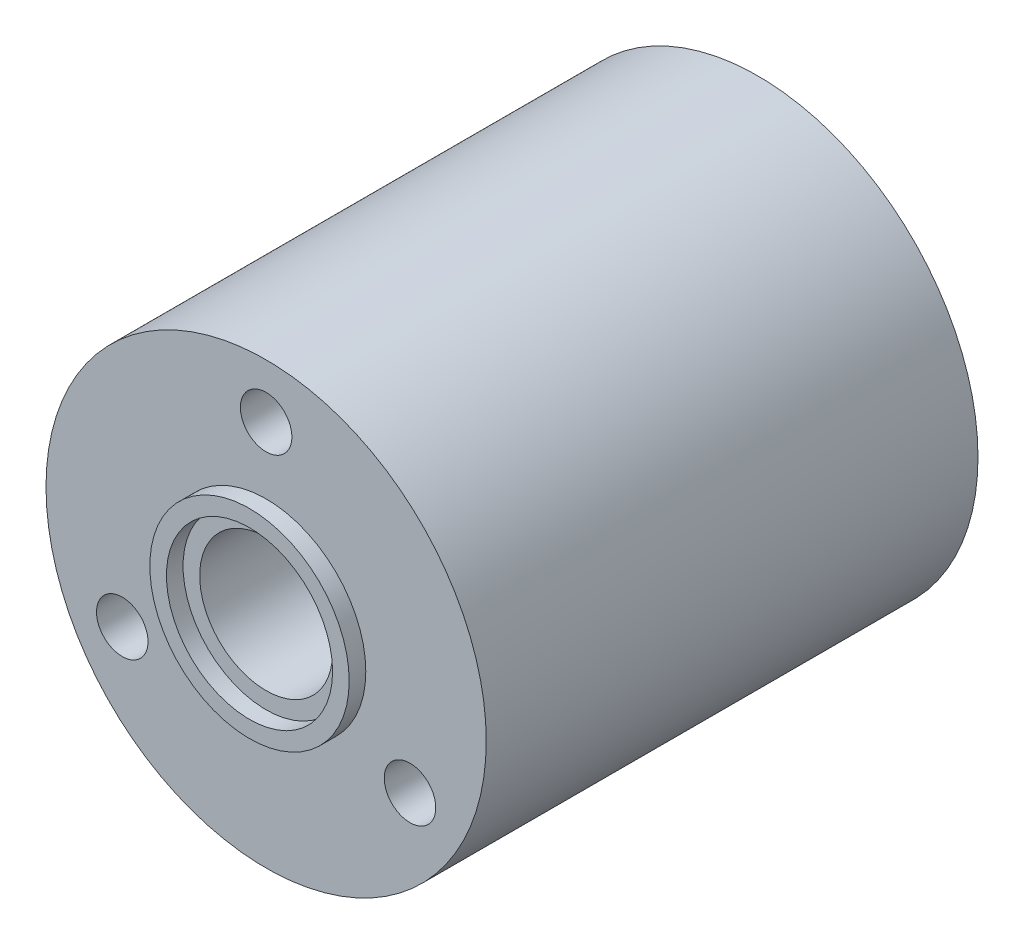
from build123d import *

# Parameters (mm, degrees)
SKETCH1_R           = 13.25
SKETCH1_R_2         = 1.55
SKETCH1_R_3         = 4
BOSS_EXTRUDE1_DEPTH = 14.8
SKETCH1_3_R         = 6
SKETCH1_3_R_2       = 5
EXTRUDE_THIN1_DEPTH = 15.8


with BuildPart() as part:
    # Sketch1 → Boss-Extrude1 (new, symmetric)
    with BuildSketch(Plane.XY):
        Circle(SKETCH1_R)
        with Locations((-8.660254038, -5)):
            Circle(SKETCH1_R_2, mode=Mode.SUBTRACT)
        with Locations((8.660254038, -5)):
            Circle(SKETCH1_R_2, mode=Mode.SUBTRACT)
        with Locations((0, 10)):
            Circle(SKETCH1_R_2, mode=Mode.SUBTRACT)
        Circle(SKETCH1_R_3, mode=Mode.SUBTRACT)
    extrude(amount=BOSS_EXTRUDE1_DEPTH, both=True)

    # Sketch1<3> → Extrude-Thin1 (add, symmetric)
    with BuildSketch(Plane.XY):
        Circle(SKETCH1_3_R)
        Circle(SKETCH1_3_R_2, mode=Mode.SUBTRACT)
    extrude(amount=EXTRUDE_THIN1_DEPTH, both=True)


solid = part.part
